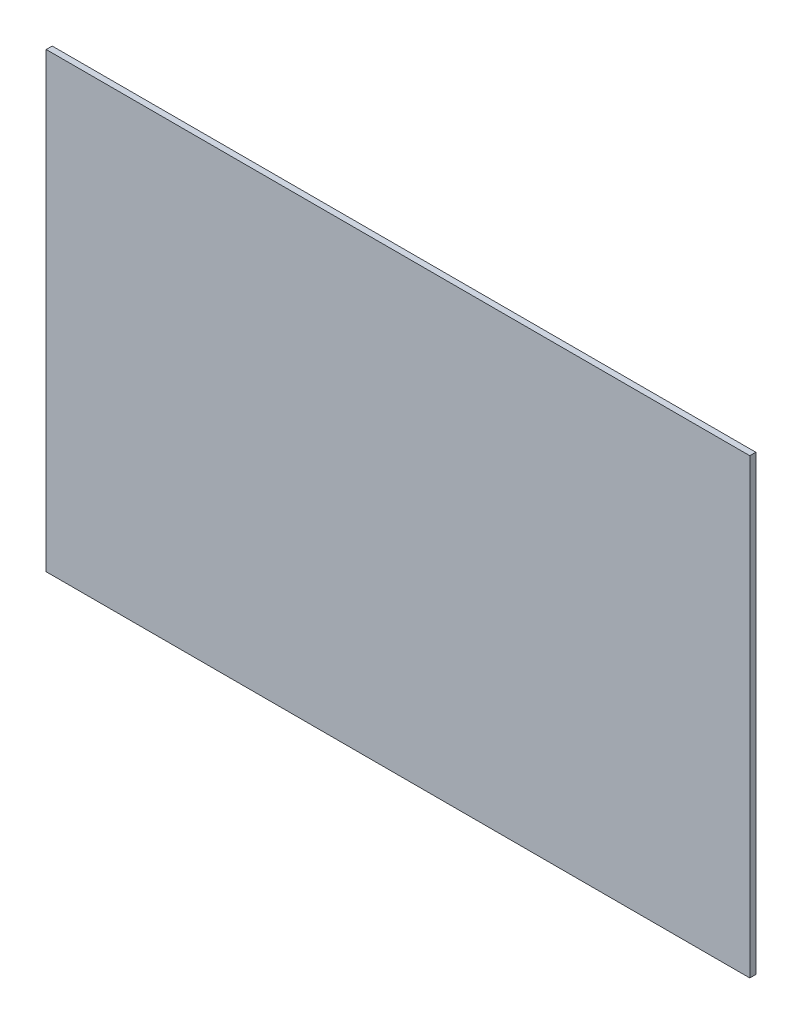
from build123d import *

# Parameters (mm, degrees)
SKETCH1_W           = 280
SKETCH1_H           = 180
BOSS_EXTRUDE1_DEPTH = 2.4


with BuildPart() as part:
    # Sketch1 → Boss-Extrude1 (new body)
    with BuildSketch(Plane.XY):
        Rectangle(SKETCH1_W, SKETCH1_H)
    extrude(amount=BOSS_EXTRUDE1_DEPTH)


solid = part.part
